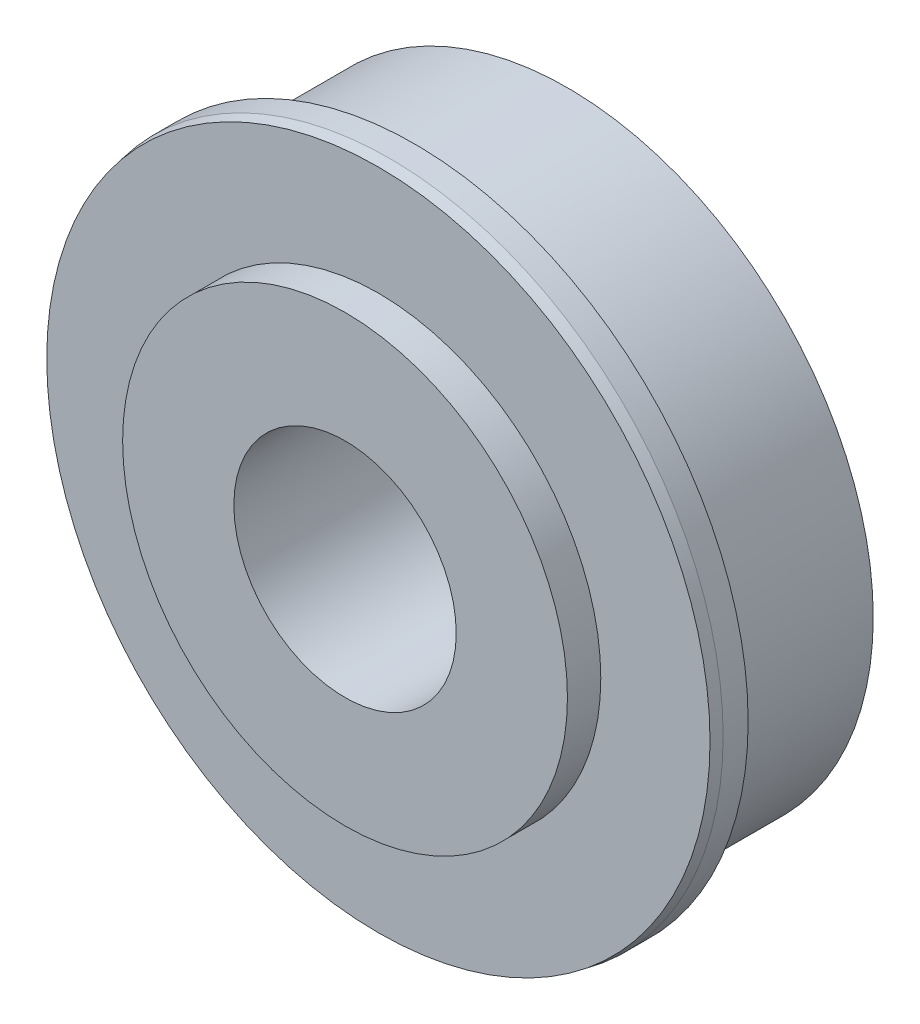
from build123d import *


with BuildPart() as part:
    # Sketch1 → Revolve1 (revolve)
    with BuildSketch(Plane(origin=(0, 0, 0), x_dir=(-1, 0, 0), z_dir=(0, 1, 0))):
        Polygon((-17.4625, -6.35), (-17.4625, 1.74625), (-17.350532367, 2.38125), (-19.05, 2.38125), (-19.05, 3.81), (-18.938032367, 4.445), (-12.7, 4.445), (-12.7, 6.35), (-6.35, 6.35), (-6.35, -6.35), align=None)
    revolve(axis=Axis((0, 0, 114.851664886), (0, 0, -1)))


solid = part.part
